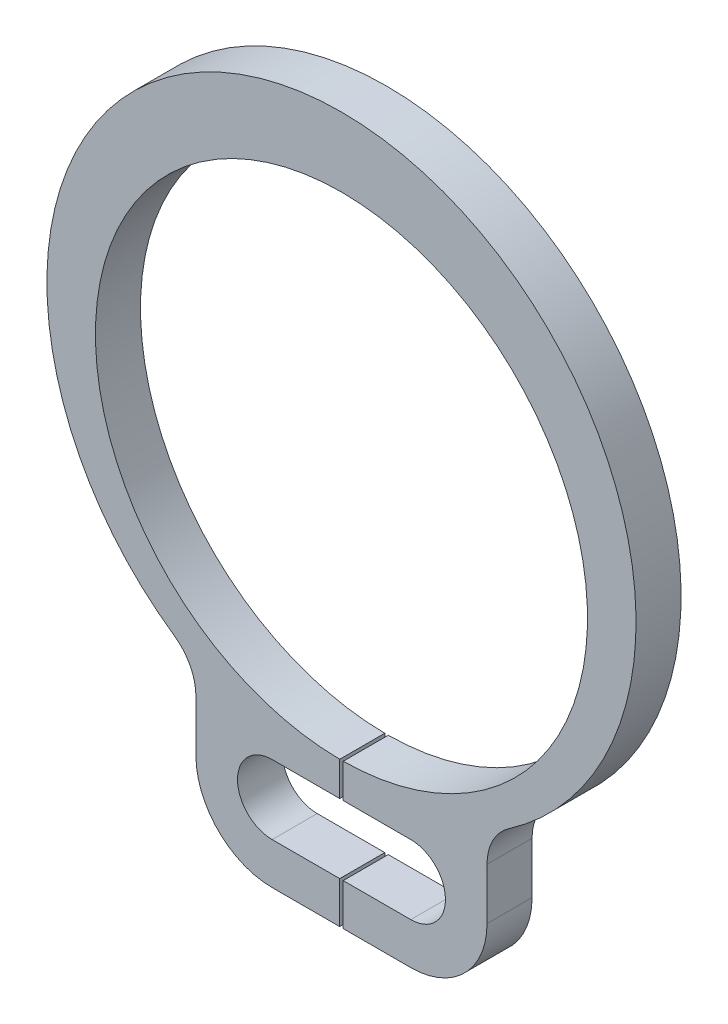
from build123d import *

# Parameters (mm, degrees)
SKETCH_1_R          = 3.55
SKETCH_1_R_2        = 0.5
EXTRUDE_1_DEPTH     = 0.65
SKETCH_2_W          = 0.05
SKETCH_2_H          = 5.641200282
CUT_EXTRUDE_1_DEPTH = 8.092823177
FILLET_1_R          = 0.733333333
CUT_EXTRUDE_2_DEPTH = 8.092823177


with BuildPart() as part:
    # 草图1 → 凸台-拉伸1 (new body)
    with BuildSketch(Plane.XY):
        with BuildLine():
            Line((-1, -5.641200282), (1, -5.641200282))
            ThreePointArc((1, -5.641200282), (1.777817459, -5.319017741), (2.1, -4.541200282))
            Line((2.1, -4.541200282), (2.1, -3.394928957))
            ThreePointArc((2.1, -3.394928957), (0, 4.55), (-2.1, -3.394928957))
            Line((-2.1, -3.394928957), (-2.1, -4.541200282))
            ThreePointArc((-2.1, -4.541200282), (-1.777817459, -5.319017741), (-1, -5.641200282))
        make_face()
        Circle(SKETCH_1_R, mode=Mode.SUBTRACT)
        with Locations((-1, -4.541200282)):
            Circle(SKETCH_1_R_2, mode=Mode.SUBTRACT)
        with Locations(Location((1, -4.541200282, 0), (0, 0, 180))):
            Circle(SKETCH_1_R_2, mode=Mode.SUBTRACT)
    extrude(amount=EXTRUDE_1_DEPTH)

    # 草图2 → 切除-拉伸1 (cut, through all)
    with BuildSketch(Plane.XY.offset(0.65)):
        with Locations((0, -2.820600141)):
            Rectangle(SKETCH_2_W, SKETCH_2_H)
    extrude(amount=-CUT_EXTRUDE_1_DEPTH, mode=Mode.SUBTRACT)

    # 圆角1
    fillet_1_edges = [part.edges().sort_by_distance(p)[0] for p in [
        (-2.1, -3.394928957, 0.325),
        (2.1, -3.394928957, 0.325),
    ]]
    fillet(fillet_1_edges, radius=FILLET_1_R)

    # 草图3 → 切除-拉伸2 (cut, through all)
    with BuildSketch(Plane.XY.offset(0.65)):
        with BuildLine():
            Line((-1, -4.041200282), (1, -4.041200282))
            ThreePointArc((1, -4.041200282), (1.5, -4.541200282), (1, -5.041200282))
            Line((1, -5.041200282), (-1, -5.041200282))
            ThreePointArc((-1, -5.041200282), (-1.5, -4.541200282), (-1, -4.041200282))
        make_face()
    extrude(amount=-CUT_EXTRUDE_2_DEPTH, mode=Mode.SUBTRACT)


solid = part.part
